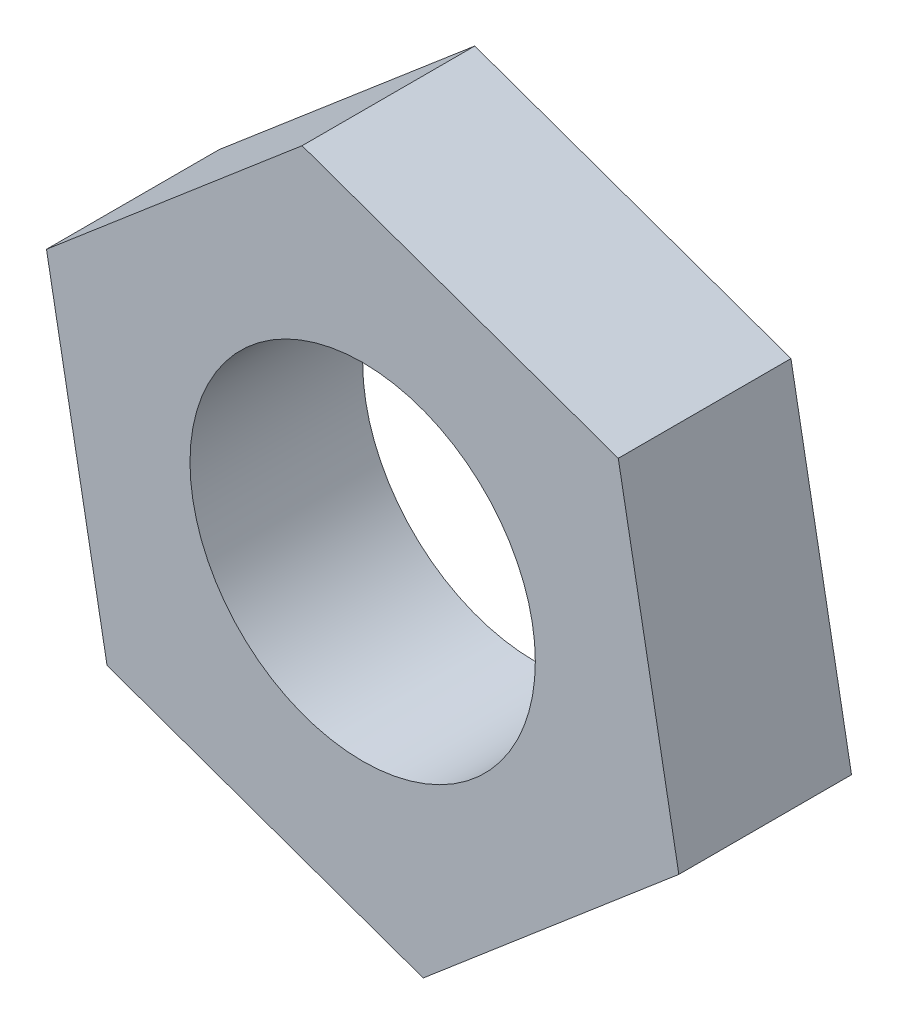
from build123d import *

# Parameters (mm, degrees)
SKETCH1_R           = 3
BOSS_EXTRUDE1_DEPTH = 3


with BuildPart() as part:
    # Sketch1 → Boss-Extrude1 (new body)
    # profile 1 of 7: a face of its own
    with BuildSketch(Plane.XY):
        with BuildLine():
            ThreePointArc((1328.13150473, -1693.072432874), (1328.496972448, -1691.186259901), (1328.13150473, -1689.300086927))
            Line((1328.13150473, -1689.300086927), (1327.422718332, -1688.072432874))
            ThreePointArc((1327.422718332, -1688.072432874), (1325.97197848, -1686.812842059), (1324.15577091, -1686.186259901))
            Line((1324.15577091, -1686.186259901), (1322.738198114, -1686.186259901))
            ThreePointArc((1322.738198114, -1686.186259901), (1320.921990544, -1686.812842059), (1319.471250692, -1688.072432874))
            Line((1319.471250692, -1688.072432874), (1318.762464294, -1689.300086927))
            ThreePointArc((1318.762464294, -1689.300086927), (1318.396996575, -1691.186259901), (1318.762464294, -1693.072432874))
            Line((1318.762464294, -1693.072432874), (1319.471250692, -1694.300086927))
            ThreePointArc((1319.471250692, -1694.300086927), (1320.921990544, -1695.559677742), (1322.738198114, -1696.186259901))
            Line((1322.738198114, -1696.186259901), (1324.15577091, -1696.186259901))
            ThreePointArc((1324.15577091, -1696.186259901), (1325.97197848, -1695.559677742), (1327.422718332, -1694.300086927))
            Line((1327.422718332, -1694.300086927), (1328.13150473, -1693.072432874))
        make_face()
        with Locations((1323.446984512, -1691.186259901)):
            Circle(SKETCH1_R, mode=Mode.SUBTRACT)
    # profile 2 of 7: a face of its own
    with BuildSketch(Plane.XY):
        with BuildLine():
            Line((1321.752495925, -1695.943474063), (1324.499074459, -1696.921787568))
            Line((1324.499074459, -1696.921787568), (1326.719608123, -1695.032337494))
            ThreePointArc((1326.719608123, -1695.032337494), (1325.519613433, -1695.791320976), (1324.15577091, -1696.186259901))
            Line((1324.15577091, -1696.186259901), (1322.738198114, -1696.186259901))
            ThreePointArc((1322.738198114, -1696.186259901), (1322.239230852, -1696.089698414), (1321.752495925, -1695.943474063))
        make_face()
    # profile 3 of 7: a face of its own
    with BuildSketch(Plane.XY):
        with BuildLine():
            ThreePointArc((1327.422718332, -1694.300086927), (1327.089609813, -1694.683924703), (1326.719608123, -1695.032337494))
            Line((1326.719608123, -1695.032337494), (1328.940142149, -1693.142887113))
            Line((1328.940142149, -1693.142887113), (1328.414095669, -1690.275115064))
            ThreePointArc((1328.414095669, -1690.275115064), (1328.471399282, -1691.693836867), (1328.13150473, -1693.072432874))
            Line((1328.13150473, -1693.072432874), (1327.422718332, -1694.300086927))
        make_face()
    # profile 4 of 7: a face of its own
    with BuildSketch(Plane.XY):
        with BuildLine():
            ThreePointArc((1328.13150473, -1689.300086927), (1328.29736254, -1689.780482129), (1328.414095669, -1690.275115064))
            Line((1328.414095669, -1690.275115064), (1327.888052202, -1687.407359446))
            Line((1327.888052202, -1687.407359446), (1325.141464891, -1686.429042814))
            ThreePointArc((1325.141464891, -1686.429042814), (1326.398766175, -1687.08877736), (1327.422718332, -1688.072432874))
            Line((1327.422718332, -1688.072432874), (1328.13150473, -1689.300086927))
        make_face()
    # profile 5 of 7: a face of its own
    with BuildSketch(Plane.XY):
        with BuildLine():
            ThreePointArc((1324.15577091, -1686.186259901), (1324.654733942, -1686.282820345), (1325.141464891, -1686.429042814))
            Line((1325.141464891, -1686.429042814), (1322.394894565, -1685.450732233))
            Line((1322.394894565, -1685.450732233), (1320.17435296, -1687.340189064))
            ThreePointArc((1320.17435296, -1687.340189064), (1321.374350836, -1686.581200964), (1322.738198114, -1686.186259901))
            Line((1322.738198114, -1686.186259901), (1324.15577091, -1686.186259901))
        make_face()
    # profile 6 of 7: a face of its own
    with BuildSketch(Plane.XY):
        with BuildLine():
            Line((1317.953826874, -1689.229632688), (1318.479872929, -1692.097402415))
            ThreePointArc((1318.479872929, -1692.097402415), (1318.42256986, -1690.67868176), (1318.762464294, -1689.300086927))
            Line((1318.762464294, -1689.300086927), (1319.471250692, -1688.072432874))
            ThreePointArc((1319.471250692, -1688.072432874), (1319.8043556, -1687.688598858), (1320.17435296, -1687.340189064))
            Line((1320.17435296, -1687.340189064), (1317.953826874, -1689.229632688))
        make_face()
    # profile 7 of 7: a face of its own
    with BuildSketch(Plane.XY):
        with BuildLine():
            Line((1319.005916822, -1694.965160355), (1321.752495925, -1695.943474063))
            ThreePointArc((1321.752495925, -1695.943474063), (1320.495199314, -1695.283739895), (1319.471250692, -1694.300086927))
            Line((1319.471250692, -1694.300086927), (1318.762464294, -1693.072432874))
            ThreePointArc((1318.762464294, -1693.072432874), (1318.596606155, -1692.592036538), (1318.479872929, -1692.097402415))
            Line((1318.479872929, -1692.097402415), (1319.005916822, -1694.965160355))
        make_face()
    extrude(amount=-BOSS_EXTRUDE1_DEPTH)


solid = part.part
